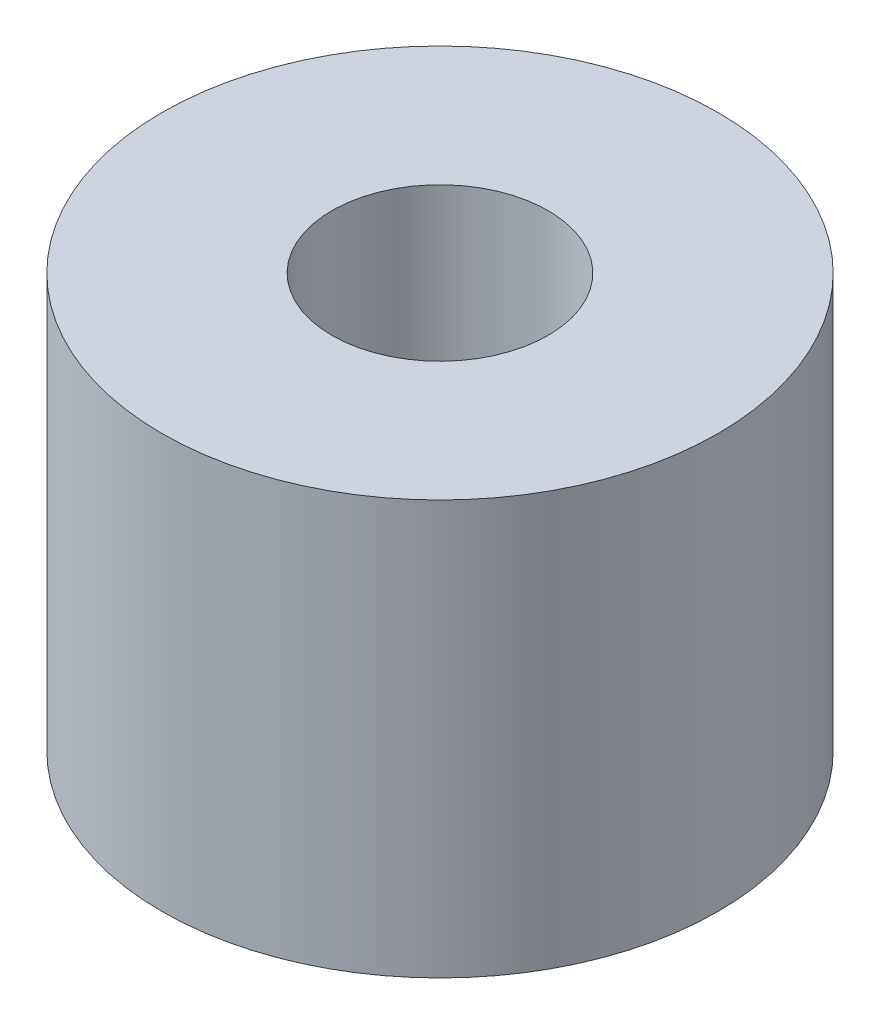
from build123d import *

# Parameters (mm, degrees)
SKETCH_2_R      = 4.5
SKETCH_2_R_2    = 1.75
EXTRUDE_1_DEPTH = 6.7


with BuildPart() as part:
    # 草图2 → 凸台-拉伸1 (new body)
    with BuildSketch(Plane(origin=(0, 0, 0), x_dir=(1, 0, 0), z_dir=(0, 1, 0))):
        with Locations(Location((0, 0, 0), (0, 0, 270))):
            Circle(SKETCH_2_R)
        with Locations(Location((0, 0, 0), (0, 0, 270))):
            Circle(SKETCH_2_R_2, mode=Mode.SUBTRACT)
    extrude(amount=EXTRUDE_1_DEPTH)


solid = part.part
